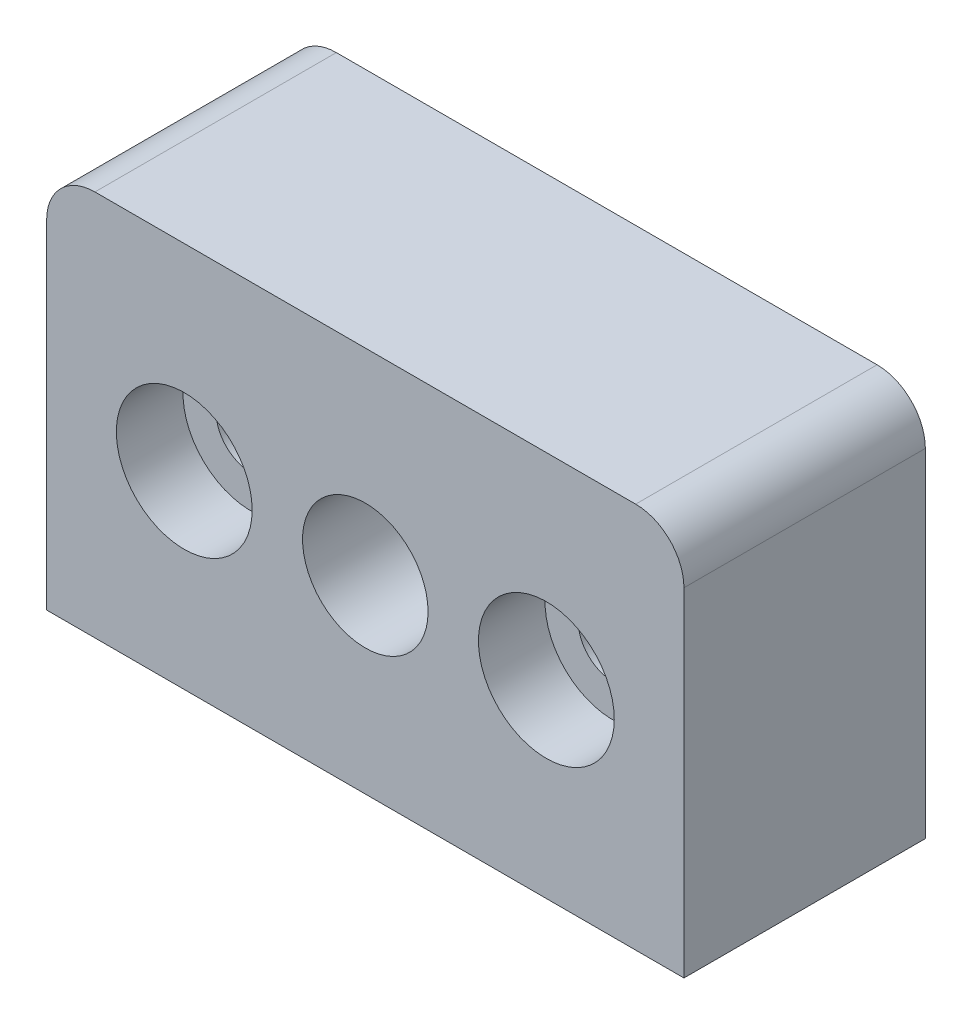
from build123d import *

# Parameters (mm, degrees)
SKETCH1_W                                      = 33.528
SKETCH1_H                                      = 20.32
BOSS_EXTRUDE1_DEPTH                            = 12.7
SKETCH2_R                                      = 3.302
CUT_EXTRUDE1_DEPTH                             = 12.7
CBORE_FOR_6_SOCKET_HEAD_CAP_SCREW1_D           = 3.6576
CBORE_FOR_6_SOCKET_HEAD_CAP_SCREW1_CBORE_D     = 7.14502
CBORE_FOR_6_SOCKET_HEAD_CAP_SCREW1_CBORE_DEPTH = 3.5052
FILLET1_R                                      = 2.54
TAP_DRILL_FOR_6_32_TAP1_D                      = 2.7051
TAP_DRILL_FOR_6_32_TAP1_DEPTH                  = 7.62
TAP_DRILL_FOR_6_32_TAP1_TIP                    = 0.81269403


with BuildPart() as part:
    # Sketch1 → Boss-Extrude1 (new body)
    with BuildSketch(Plane.XY):
        with Locations((16.764, 10.16)):
            Rectangle(SKETCH1_W, SKETCH1_H)
    extrude(amount=BOSS_EXTRUDE1_DEPTH)

    # Sketch2 → Cut-Extrude1 (cut)
    with BuildSketch(Plane.XY.offset(12.7)):
        with Locations((16.764, 9.9568)):
            Circle(SKETCH2_R)
    extrude(amount=-CUT_EXTRUDE1_DEPTH, mode=Mode.SUBTRACT)

    # CBORE for #6 Socket Head Cap Screw1 (through all)
    with Locations(Plane.XY.offset(12.7)):
        with Locations((26.289, 9.9568), (7.239, 9.9568)):
            CounterBoreHole(CBORE_FOR_6_SOCKET_HEAD_CAP_SCREW1_D / 2, CBORE_FOR_6_SOCKET_HEAD_CAP_SCREW1_CBORE_D / 2, CBORE_FOR_6_SOCKET_HEAD_CAP_SCREW1_CBORE_DEPTH)

    # Fillet1
    fillet1_edges = [part.edges().sort_by_distance(p)[0] for p in [
        (0, 20.32, 6.35),
        (33.528, 20.32, 6.35),
    ]]
    fillet(fillet1_edges, radius=FILLET1_R)

    # Tap Drill for #6-32 Tap1
    with Locations(Plane(origin=(0, 0, 0), x_dir=(-1, 0, 0), z_dir=(0, -1, 0))):
        with Locations((-22.098, -6.35), (-11.43, -6.35)):
            Hole(TAP_DRILL_FOR_6_32_TAP1_D / 2, depth=TAP_DRILL_FOR_6_32_TAP1_DEPTH)
            with Locations((0, 0, -(TAP_DRILL_FOR_6_32_TAP1_DEPTH + TAP_DRILL_FOR_6_32_TAP1_TIP / 2))):  # 118° drill point
                Cone(0, TAP_DRILL_FOR_6_32_TAP1_D / 2, TAP_DRILL_FOR_6_32_TAP1_TIP, mode=Mode.SUBTRACT)


solid = part.part
